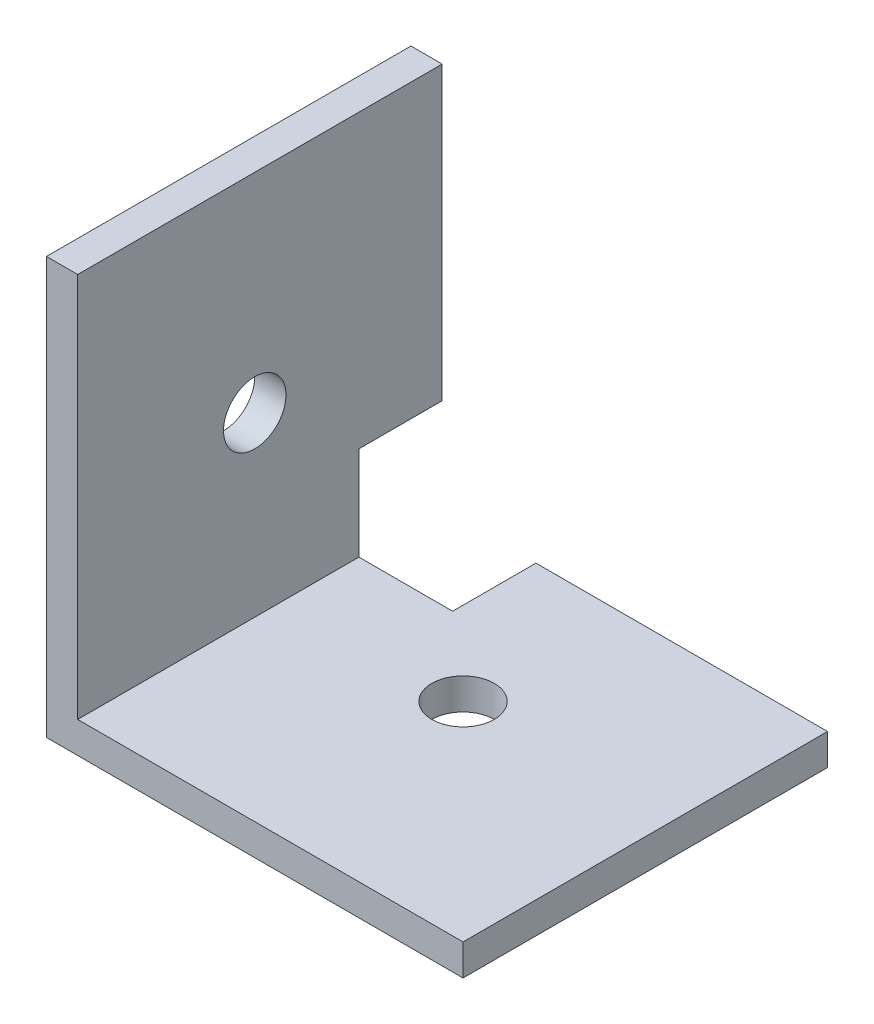
from build123d import *

# Parameters (mm, degrees)
EXTRUSION1_DEPTH = 17.5
ESQUISSE7_R      = 1.5
EXTRUSION7_DEPTH = 33.380549717
ESQUISSE9_R      = 1.5
EXTRUSION8_DEPTH = 33.380549717
ESQUISSE10_W     = 4
ESQUISSE10_H     = 6
EXTRUSION9_DEPTH = 6


with BuildPart() as part:
    # Esquisse1 → Extrusion1 (new body)
    with BuildSketch(Plane.XY):
        Polygon((0, 0), (20, 0), (20, 1.5), (1.5, 1.5), (1.5, 20), (0, 20), align=None)
    extrude(amount=EXTRUSION1_DEPTH)

    # Esquisse7 → Extrusion7 (cut, through all)
    with BuildSketch(Plane(origin=(0, 1.5, 0), x_dir=(-1, 0, 0), z_dir=(0, 1, 0))):
        with Locations((-10, 7.5)):
            Circle(ESQUISSE7_R)
    extrude(amount=-EXTRUSION7_DEPTH, mode=Mode.SUBTRACT)

    # Esquisse9 → Extrusion8 (cut, through all)
    with BuildSketch(Plane(origin=(1.5, 0, 0), x_dir=(0, 0, -1), z_dir=(1, 0, 0))):
        with Locations(Location((-9, 10, 0), (0, 0, 90))):
            Circle(ESQUISSE9_R)
    extrude(amount=-EXTRUSION8_DEPTH, mode=Mode.SUBTRACT)

    # Esquisse10 → Extrusion9 (cut)
    with BuildSketch(Plane.ZY):
        with Locations((2, 3)):
            Rectangle(ESQUISSE10_W, ESQUISSE10_H)
    extrude(amount=-EXTRUSION9_DEPTH, mode=Mode.SUBTRACT)


solid = part.part
